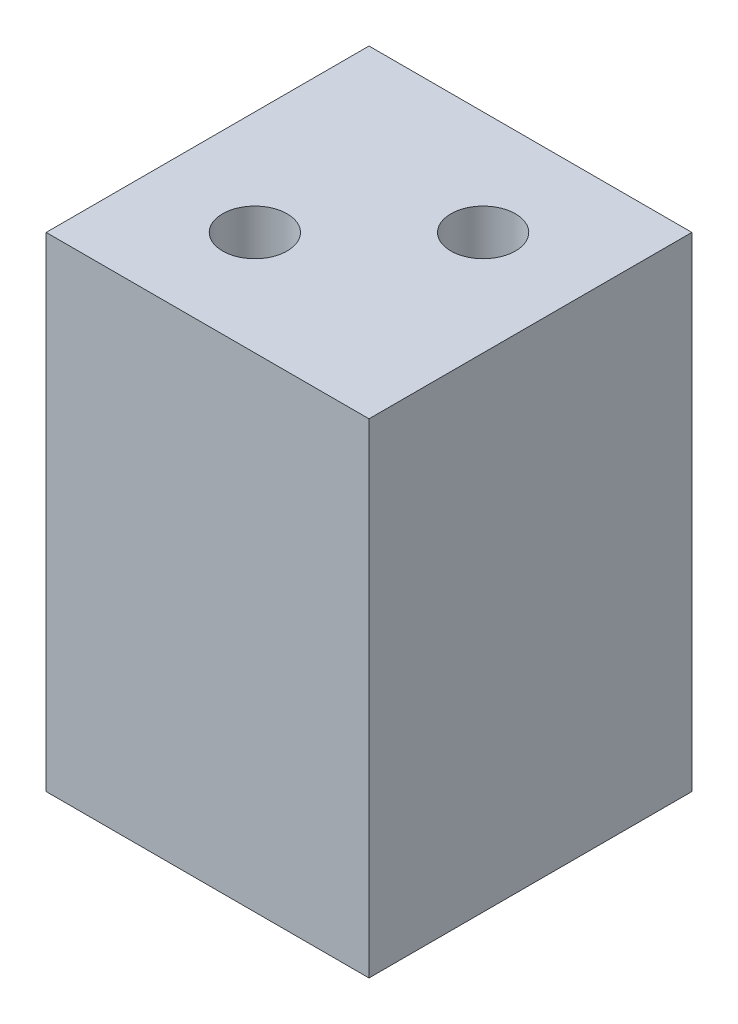
from build123d import *

# Parameters (mm, degrees)
SKETCH1_W           = 30
SKETCH1_H           = 30
SKETCH1_R           = 3
BOSS_EXTRUDE1_DEPTH = 45


with BuildPart() as part:
    # Sketch1 → Boss-Extrude1 (new body)
    with BuildSketch(Plane(origin=(0, 0, 0), x_dir=(1, 0, 0), z_dir=(0, 1, 0))):
        Rectangle(SKETCH1_W, SKETCH1_H)
        with Locations(Location((-5.303300859, -5.303300859, 0), (0, 0, 90))):
            Circle(SKETCH1_R, mode=Mode.SUBTRACT)
        with Locations(Location((5.303300859, 5.303300859, 0), (0, 0, 90))):
            Circle(SKETCH1_R, mode=Mode.SUBTRACT)
    extrude(amount=BOSS_EXTRUDE1_DEPTH)


solid = part.part
